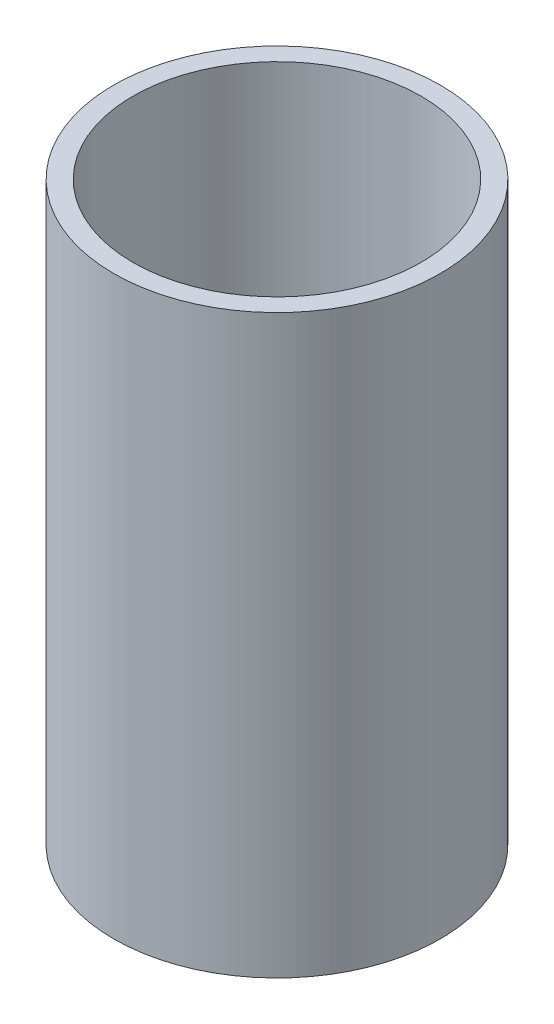
from build123d import *

# Parameters (mm, degrees)
SKETCH3_R           = 17
SKETCH3_R_2         = 15
BOSS_EXTRUDE1_DEPTH = 60


with BuildPart() as part:
    # Sketch3 → Boss-Extrude1 (new body)
    with BuildSketch(Plane(origin=(0, 0, 0), x_dir=(1, 0, 0), z_dir=(0, 1, 0))):
        with Locations(Location((0, 0, 0), (0, 0, 270))):
            Circle(SKETCH3_R)
        with Locations(Location((0, 0, 0), (0, 0, 270))):
            Circle(SKETCH3_R_2, mode=Mode.SUBTRACT)
    extrude(amount=BOSS_EXTRUDE1_DEPTH)


solid = part.part
